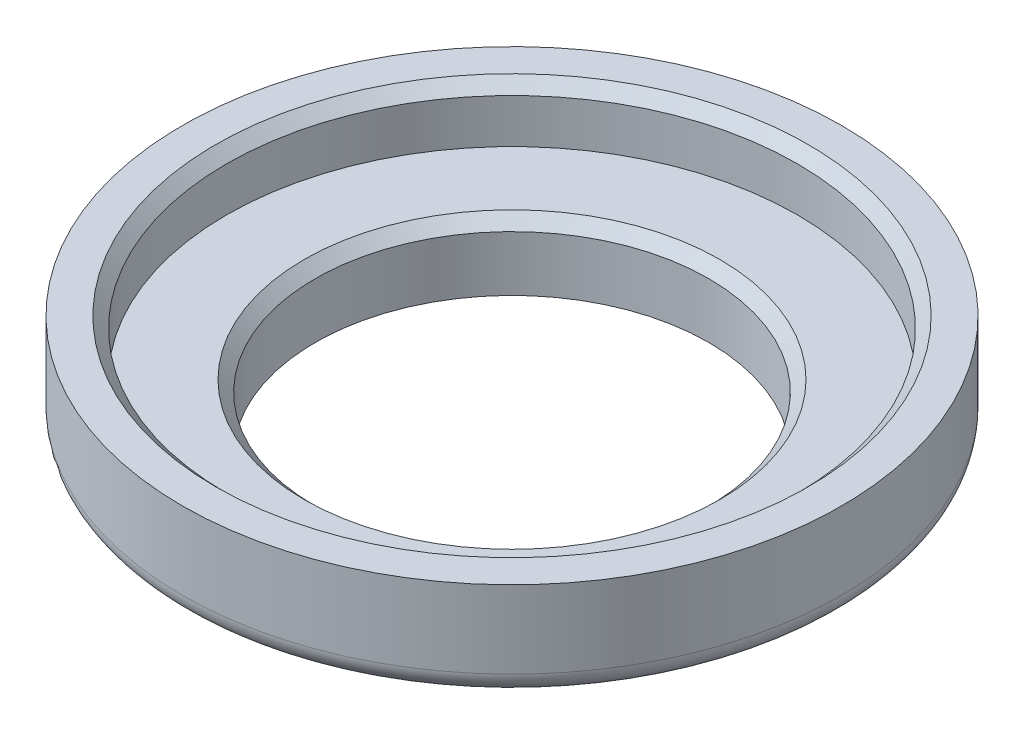
from build123d import *

# Parameters (mm, degrees)
FILLET1_R     = 1
CHAMFER1_SIZE = 0.5


with BuildPart() as part:
    # Sketch1 → Revolve1 (revolve)
    with BuildSketch(Plane.XY, mode=Mode.PRIVATE) as revolve1_sk:
        Polygon((12.9, 5.5), (12.9, 3), (8.9, 3), (8.9, 0), (10.9, 0), (10.9, 1), (14.9, 1), (14.9, 5.5), align=None)
    revolve(revolve1_sk.sketch.rotate(Axis((0, 0, 0), (0, 1, 0)), 90), axis=Axis((0, 0, 0), (0, 1, 0)))

    # Fillet1
    fillet1_edges = [part.edges().sort_by_distance(p)[0] for p in [
        (0, 1, 14.9),
    ]]
    fillet(fillet1_edges, radius=FILLET1_R)

    # Chamfer1
    chamfer1_edges = [part.edges().sort_by_distance(p)[0] for p in [
        (0, 5.5, 12.9),
        (0, 3, 8.9),
    ]]
    chamfer(chamfer1_edges, length=CHAMFER1_SIZE)


solid = part.part
